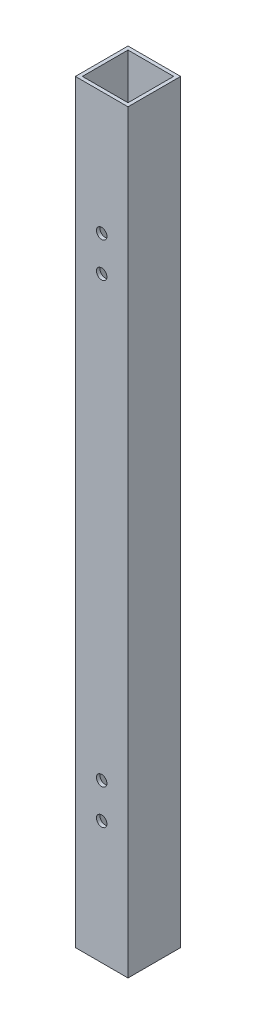
from build123d import *

# Parameters (mm, degrees)
BOSS_EXTRUDE1_DEPTH = 430
SKETCH2_W           = 26
SKETCH2_H           = 26
CUT_EXTRUDE1_DEPTH  = 430
SKETCH3_R           = 3
CUT_EXTRUDE2_DEPTH  = 30


with BuildPart() as part:
    # Sketch1 → Boss-Extrude1 (new body)
    with BuildSketch(Plane(origin=(0, 0, 0), x_dir=(1, 0, 0), z_dir=(0, 1, 0))):
        Polygon((-15, 0), (-15, 15), (15, 15), (15, -15), (-15, -15), align=None)
    extrude(amount=BOSS_EXTRUDE1_DEPTH)

    # Sketch2 → Cut-Extrude1 (cut)
    with BuildSketch(Plane(origin=(0, 430, 0), x_dir=(1, 0, 0), z_dir=(0, 1, 0))):
        Rectangle(SKETCH2_W, SKETCH2_H)
    extrude(amount=-CUT_EXTRUDE1_DEPTH, mode=Mode.SUBTRACT)

    # Sketch3 → Cut-Extrude2 (cut)
    with BuildSketch(Plane.XY.offset(15)):
        with Locations((0, 360)):
            Circle(SKETCH3_R)
        with Locations((0, 340)):
            Circle(SKETCH3_R)
        with Locations((0, 90)):
            Circle(SKETCH3_R)
        with Locations((0, 70)):
            Circle(SKETCH3_R)
    extrude(amount=-CUT_EXTRUDE2_DEPTH, mode=Mode.SUBTRACT)


solid = part.part
